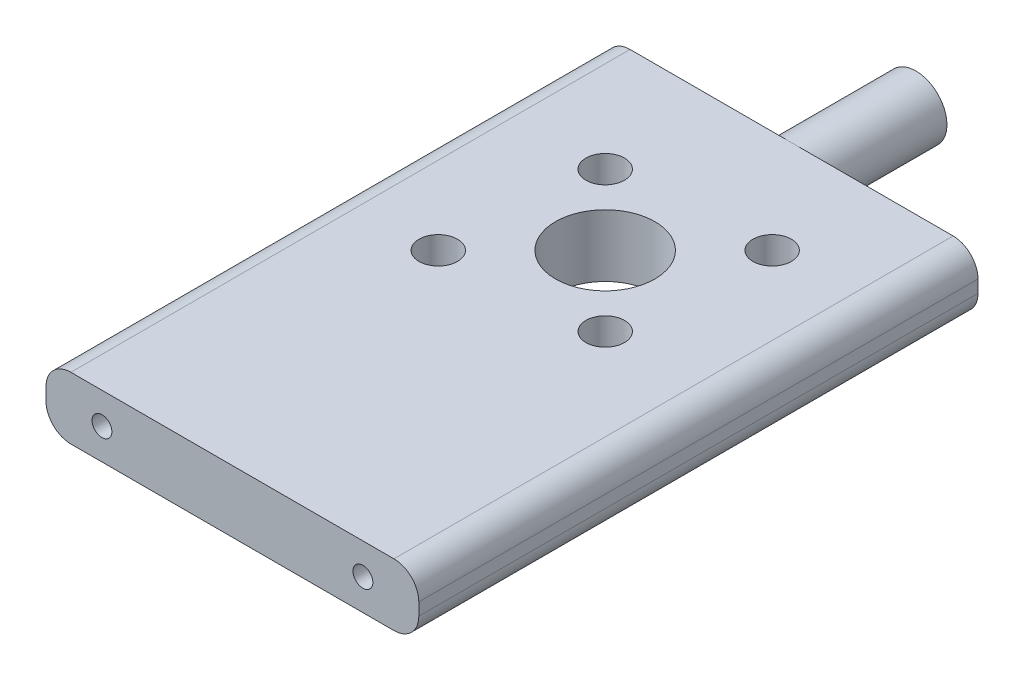
from build123d import *

# Parameters (mm, degrees)
SKETCH1_W           = 30
SKETCH1_H           = 45
BOSS_EXTRUDE1_DEPTH = 5
SKETCH2_R           = 4
CUT_EXTRUDE1_DEPTH  = 5
SKETCH3_R           = 1.55
CUT_EXTRUDE2_DEPTH  = 5
SKETCH4_R           = 0.8
CUT_EXTRUDE3_DEPTH  = 5
SKETCH5_R           = 2.5
BOSS_EXTRUDE2_DEPTH = 10
FILLET1_R           = 2


with BuildPart() as part:
    # Sketch1 → Boss-Extrude1 (new body)
    with BuildSketch(Plane(origin=(0, 0, 0), x_dir=(1, 0, 0), z_dir=(0, 1, 0))):
        with Locations((7.687417977, 3.694491888)):
            Rectangle(SKETCH1_W, SKETCH1_H)
    extrude(amount=BOSS_EXTRUDE1_DEPTH)

    # Sketch2 → Cut-Extrude1 (cut)
    with BuildSketch(Plane(origin=(0, 5, 0), x_dir=(-1, 0, 0), z_dir=(0, 1, 0))):
        with Locations(Location((-7.687417977, -11.194491888, 0), (0, 0, 90))):
            Circle(SKETCH2_R)
    extrude(amount=-CUT_EXTRUDE1_DEPTH, mode=Mode.SUBTRACT)

    # Sketch3 → Cut-Extrude2 (cut)
    with BuildSketch(Plane(origin=(0, 5, 0), x_dir=(1, 0, 0), z_dir=(0, 1, 0))):
        with Locations(Location((2.030563727, 16.851346138, 0), (0, 0, 270))):
            Circle(SKETCH3_R)
        with Locations(Location((14.404932398, 17.912006309, 0), (0, 0, 270))):
            Circle(SKETCH3_R)
        with Locations(Location((13.344272226, 5.537637639, 0), (0, 0, 270))):
            Circle(SKETCH3_R)
        with Locations(Location((0.969903556, 4.476977467, 0), (0, 0, 270))):
            Circle(SKETCH3_R)
    extrude(amount=-CUT_EXTRUDE2_DEPTH, mode=Mode.SUBTRACT)

    # Sketch4 → Cut-Extrude3 (cut)
    with BuildSketch(Plane.XY.offset(18.805508112)):
        with Locations((-2.812582023, 2.5)):
            Circle(SKETCH4_R)
        with Locations((18.187417977, 2.5)):
            Circle(SKETCH4_R)
    extrude(amount=-CUT_EXTRUDE3_DEPTH, mode=Mode.SUBTRACT)

    # Sketch5 → Boss-Extrude2 (add)
    with BuildSketch(Plane(origin=(0, 0, -26.194491888), x_dir=(-1, 0, 0), z_dir=(0, 0, -1))):
        with Locations(Location((-7.687417977, 2.5, 0), (0, 0, 270))):
            Circle(SKETCH5_R)
    extrude(amount=BOSS_EXTRUDE2_DEPTH)

    # Fillet1
    fillet1_edges = [part.edges().sort_by_distance(p)[0] for p in [
        (-7.312582023, 5, -3.694491888),
        (22.687417977, 5, -3.694491888),
        (-7.312582023, 0, -3.694491888),
        (22.687417977, 0, -3.694491888),
    ]]
    fillet(fillet1_edges, radius=FILLET1_R)


solid = part.part
